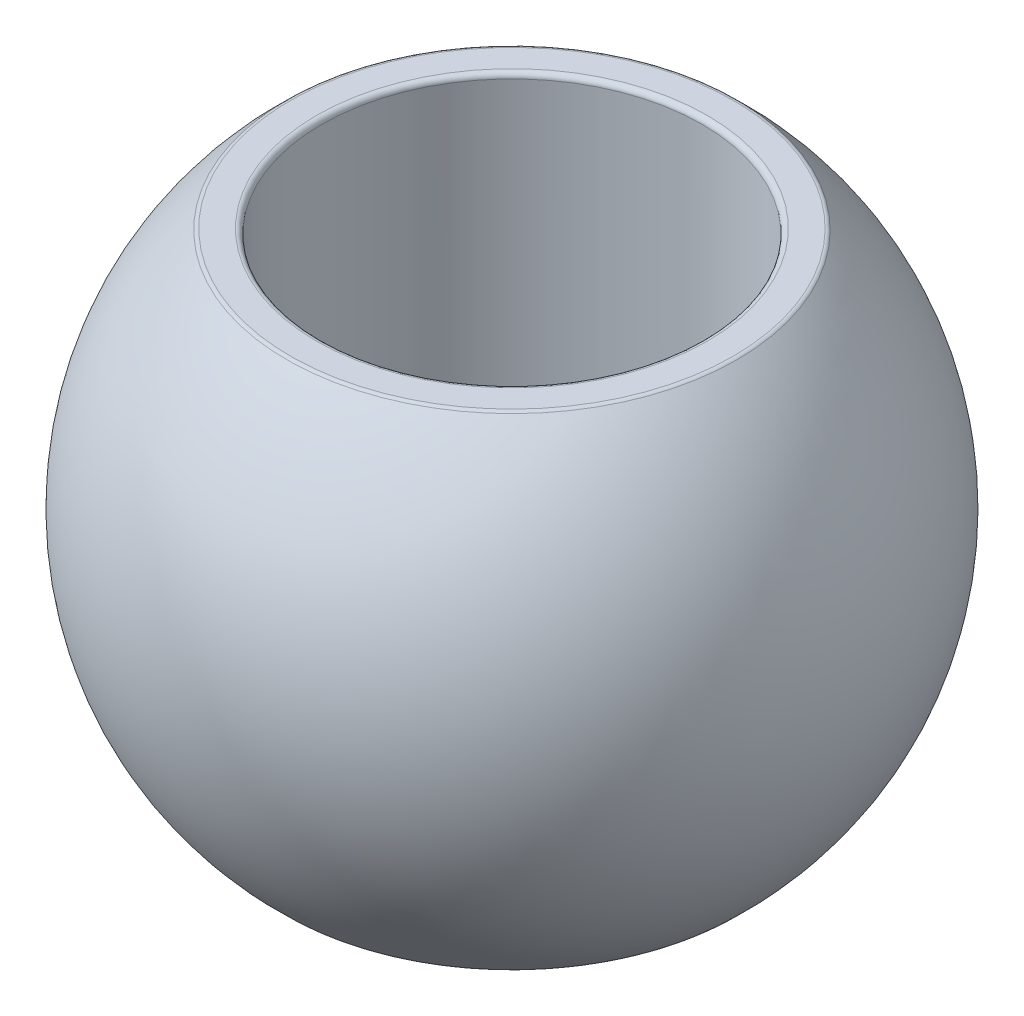
from build123d import *

# Parameters (mm, degrees)
FILLET1_R = 0.3


with BuildPart() as part:
    # Sketch1 → Revolve1 (revolve)
    with BuildSketch(Plane.XY):
        with BuildLine():
            Line((12.919075044, 14), (11, 14))
            Line((11, 14), (11, -14))
            Line((11, -14), (12.919075044, -14))
            ThreePointArc((12.919075044, -14), (19.05, 0), (12.919075044, 14))
        make_face()
    revolve(axis=Axis((0, 14, 0), (0, -1, 0)))

    # Fillet1
    fillet1_edges = [part.edges().sort_by_distance(p)[0] for p in [
        (-12.919075044, -14, 0),
        (-11, -14, 0),
        (-11, 14, 0),
        (-12.919075044, 14, 0),
    ]]
    fillet(fillet1_edges, radius=FILLET1_R)


solid = part.part
